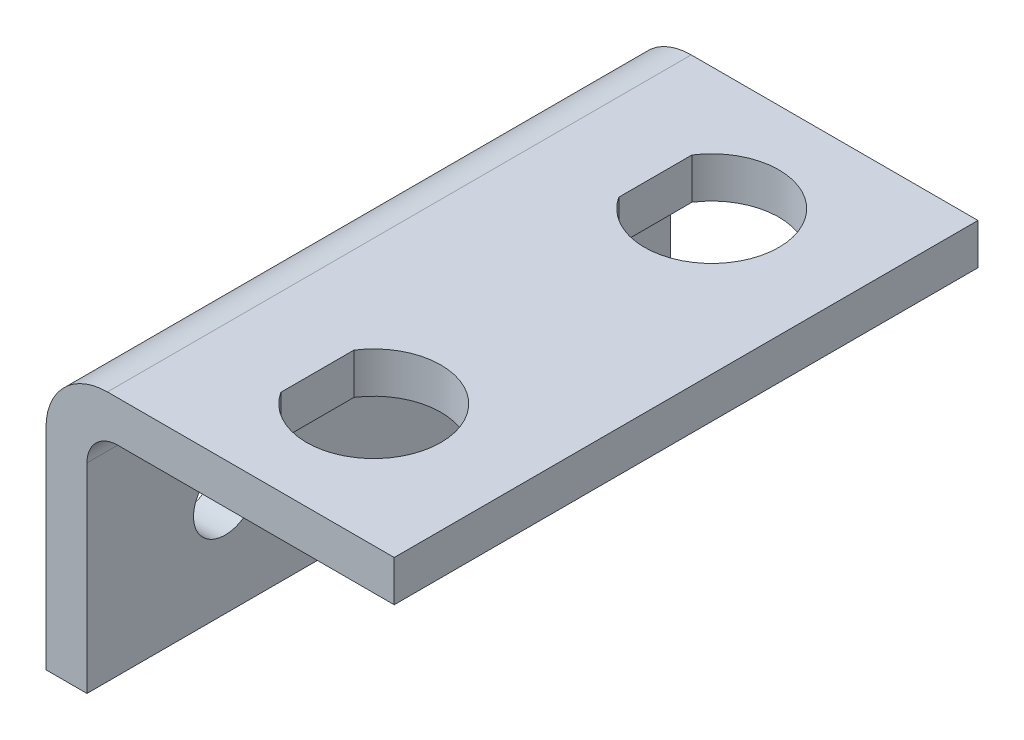
from build123d import *

# Parameters (mm, degrees)
BOSS_EXTRUDE1_DEPTH      = 14.25
BOSS_EXTRUDE1_DEPTH_BACK = 14.25
CUT_EXTRUDE1_REACH       = 27.192
CUT_EXTRUDE2_REACH       = 25.55
SKETCH3_R                = 1.55


with BuildPart() as part:
    # Sketch1 → Boss-Extrude1 (new, two sides: drawn at the far end of the back side and taken through both)
    with BuildSketch(Plane.XY.offset(-BOSS_EXTRUDE1_DEPTH_BACK)):
        with BuildLine():
            Line((1, 0), (1, 7.75))
            ThreePointArc((1, 7.75), (1.439339828, 8.810660172), (2.5, 9.25))
            Line((2.5, 9.25), (14, 9.25))
            Line((14, 9.25), (16, 9.25))
            Line((16, 9.25), (16, 11.25))
            Line((16, 11.25), (14, 11.25))
            Line((14, 11.25), (2, 11.25))
            ThreePointArc((2, 11.25), (-0.121320344, 10.371320344), (-1, 8.25))
            Line((-1, 8.25), (-1, 0))
            Line((-1, 0), (-1, -2))
            Line((-1, -2), (1, -2))
            Line((1, -2), (1, 0))
        make_face()
    extrude(amount=BOSS_EXTRUDE1_DEPTH + BOSS_EXTRUDE1_DEPTH_BACK)

    # Sketch2 → Cut-Extrude1 (cut, up to next)
    with BuildSketch(Plane(origin=(0, 11.25, 0), x_dir=(1, 0, 0), z_dir=(0, 1, 0)), mode=Mode.PRIVATE) as cut_extrude1_sk1:
        with BuildLine():
            Line((6.248241471, -10.035), (6.248241471, -6.465))
            ThreePointArc((6.248241471, -6.465), (12.28, -8.25), (6.248241471, -10.035))
        make_face()
    cut_extrude1_tool1 = extrude(cut_extrude1_sk1.sketch, amount=-CUT_EXTRUDE1_REACH, mode=Mode.PRIVATE) & part.part
    # Sketch2 → Cut-Extrude1 (cut, up to next)
    with BuildSketch(Plane(origin=(0, 11.25, 0), x_dir=(1, 0, 0), z_dir=(0, 1, 0)), mode=Mode.PRIVATE) as cut_extrude1_sk2:
        with BuildLine():
            Line((6.248241471, 6.465), (6.248241471, 10.035))
            ThreePointArc((6.248241471, 10.035), (12.28, 8.25), (6.248241471, 6.465))
        make_face()
    cut_extrude1_tool2 = extrude(cut_extrude1_sk2.sketch, amount=-CUT_EXTRUDE1_REACH, mode=Mode.PRIVATE) & part.part
    add(cut_extrude1_tool1.solids().sort_by_distance((9.116595, 11.25, 8.25))[0], mode=Mode.SUBTRACT)
    add(cut_extrude1_tool2.solids().sort_by_distance((9.116595, 11.25, -8.25))[0], mode=Mode.SUBTRACT)

    # Sketch3 → Cut-Extrude2 (cut, up to next)
    with BuildSketch(Plane(origin=(1, 0, 0), x_dir=(0, 0, -1), z_dir=(1, 0, 0)), mode=Mode.PRIVATE) as cut_extrude2_sk1:
        with Locations((-7.5, 2.875)):
            Circle(SKETCH3_R)
    cut_extrude2_tool1 = extrude(cut_extrude2_sk1.sketch, amount=-CUT_EXTRUDE2_REACH, mode=Mode.PRIVATE) & part.part
    # Sketch3 → Cut-Extrude2 (cut, up to next)
    with BuildSketch(Plane(origin=(1, 0, 0), x_dir=(0, 0, -1), z_dir=(1, 0, 0)), mode=Mode.PRIVATE) as cut_extrude2_sk2:
        with Locations((7.5, 2.875)):
            Circle(SKETCH3_R)
    cut_extrude2_tool2 = extrude(cut_extrude2_sk2.sketch, amount=-CUT_EXTRUDE2_REACH, mode=Mode.PRIVATE) & part.part
    add(cut_extrude2_tool1.solids().sort_by_distance((1, 2.875, 7.5))[0], mode=Mode.SUBTRACT)
    add(cut_extrude2_tool2.solids().sort_by_distance((1, 2.875, -7.5))[0], mode=Mode.SUBTRACT)


solid = part.part
